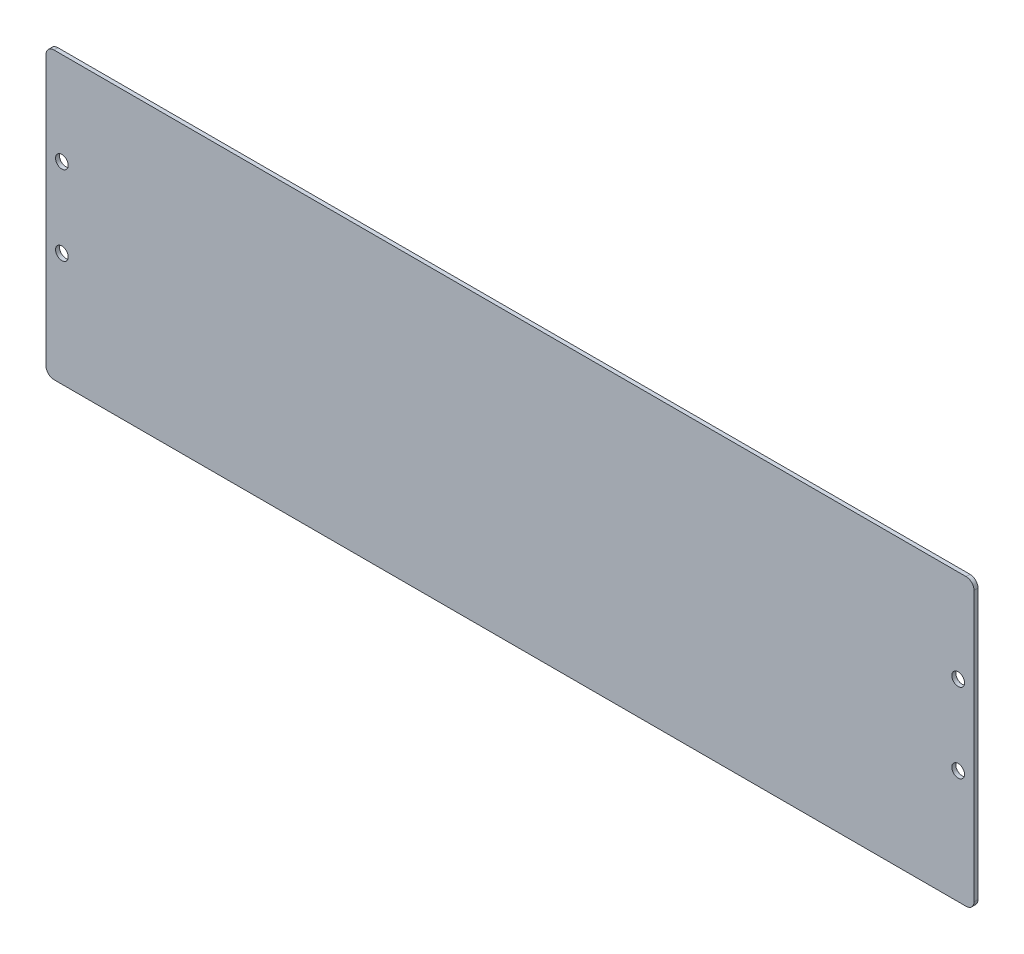
from build123d import *

# Parameters (mm, degrees)
SKETCH_1_W      = 234
SKETCH_1_H      = 72
SKETCH_1_R      = 1.6
EXTRUDE_1_DEPTH = 1
FILLET_1_R      = 2


with BuildPart() as part:
    # 草图1 → 凸台-拉伸1 (new body)
    with BuildSketch(Plane.XY):
        Rectangle(SKETCH_1_W, SKETCH_1_H)
        with Locations((-113, 12.6)):
            Circle(SKETCH_1_R, mode=Mode.SUBTRACT)
        with Locations((-113, -7.4)):
            Circle(SKETCH_1_R, mode=Mode.SUBTRACT)
        with Locations(Location((113, -7.4, 0), (0, 0, 180))):
            Circle(SKETCH_1_R, mode=Mode.SUBTRACT)
        with Locations(Location((113, 12.6, 0), (0, 0, 180))):
            Circle(SKETCH_1_R, mode=Mode.SUBTRACT)
    extrude(amount=EXTRUDE_1_DEPTH)

    # 圆角1
    fillet_1_edges = [part.edges().sort_by_distance(p)[0] for p in [
        (117, -36, 0.5),
        (-117, -36, 0.5),
        (-117, 36, 0.5),
        (117, 36, 0.5),
    ]]
    fillet(fillet_1_edges, radius=FILLET_1_R)


solid = part.part
